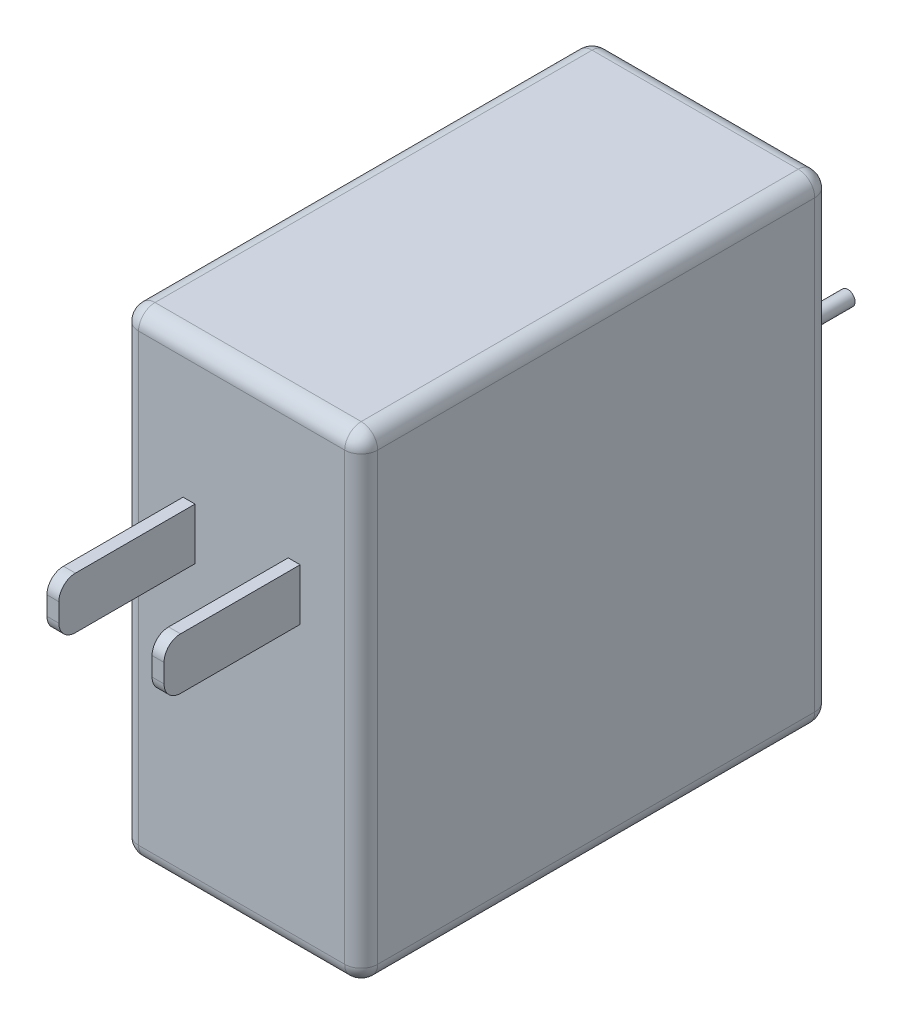
from build123d import *

# Parameters (mm, degrees)
SKETCH1_W           = 29
SKETCH1_H           = 58
BOSS_EXTRUDE1_DEPTH = 57
SKETCH1_3_W         = 1.45
SKETCH1_3_H         = 6.26
BOSS_EXTRUDE2_DEPTH = 16.51
FILLET1_R           = 2
SKETCH2_R           = 0.882124602
BOSS_EXTRUDE3_DEPTH = 16.51
SKETCH2_3_R         = 1.888458119
SKETCH2_3_R_2       = 0.882124602
BOSS_EXTRUDE4_DEPTH = 8
FILLET2_R           = 1


with BuildPart() as part:
    # Sketch1 → Boss-Extrude1 (new body)
    with BuildSketch(Plane.XY):
        Rectangle(SKETCH1_W, SKETCH1_H)
    extrude(amount=-BOSS_EXTRUDE1_DEPTH)

    # Sketch1<3> → Boss-Extrude2 (add)
    with BuildSketch(Plane.XY):
        with Locations((-6.375, 9.13)):
            Rectangle(SKETCH1_3_W, SKETCH1_3_H)
        with Locations((6.375, 9.13)):
            Rectangle(SKETCH1_3_W, SKETCH1_3_H)
    extrude(amount=BOSS_EXTRUDE2_DEPTH)

    # Fillet1
    fillet1_edges = [part.edges().sort_by_distance(p)[0] for p in [
        (-14.5, 29, -28.5),
        (0, 29, -57),
        (14.5, 29, -28.5),
        (0, 29, 0),
        (-6.375, 12.26, 16.51),
        (-6.375, 6, 16.51),
        (6.375, 6, 16.51),
        (6.375, 12.26, 16.51),
        (0, -29, 0),
        (-14.5, 0, 0),
        (-14.5, 0, -57),
        (-14.5, -29, -28.5),
        (0, -29, -57),
        (14.5, -29, -28.5),
        (14.5, 0, -57),
        (14.5, 0, 0),
    ]]
    fillet(fillet1_edges, radius=FILLET1_R)

    # Sketch2 → Boss-Extrude3 (add)
    with BuildSketch(Plane(origin=(0, 0, -57), x_dir=(-1, 0, 0), z_dir=(0, 0, -1))):
        Circle(SKETCH2_R)
    extrude(amount=BOSS_EXTRUDE3_DEPTH)

    # Sketch2<3> → Boss-Extrude4 (add)
    with BuildSketch(Plane(origin=(0, 0, -57), x_dir=(-1, 0, 0), z_dir=(0, 0, -1))):
        Circle(SKETCH2_3_R)
        Circle(SKETCH2_3_R_2, mode=Mode.SUBTRACT)
    extrude(amount=BOSS_EXTRUDE4_DEPTH)

    # Fillet2
    fillet2_edges = [part.edges().sort_by_distance(p)[0] for p in [
        (1.888458119, 0, -65),
    ]]
    fillet(fillet2_edges, radius=FILLET2_R)


solid = part.part
